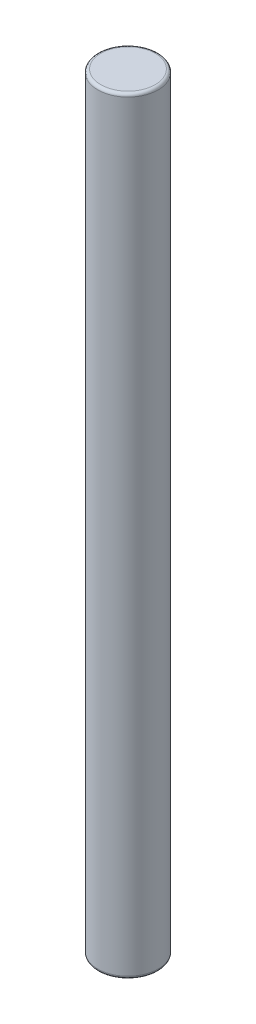
from build123d import *

# Parameters (mm, degrees)
SKETCH1_R           = 5
BOSS_EXTRUDE1_DEPTH = 127
FILLET1_R           = 0.5


with BuildPart() as part:
    # Sketch1 → Boss-Extrude1 (new body)
    with BuildSketch(Plane(origin=(0, 0, 0), x_dir=(1, 0, 0), z_dir=(0, 1, 0))):
        with Locations(Location((0, 0, 0), (0, 0, 270))):
            Circle(SKETCH1_R)
    extrude(amount=BOSS_EXTRUDE1_DEPTH)

    # Fillet1
    fillet1_edges = [part.edges().sort_by_distance(p)[0] for p in [
        (0, 0, -5),
        (0, 127, -5),
    ]]
    fillet(fillet1_edges, radius=FILLET1_R)


solid = part.part
